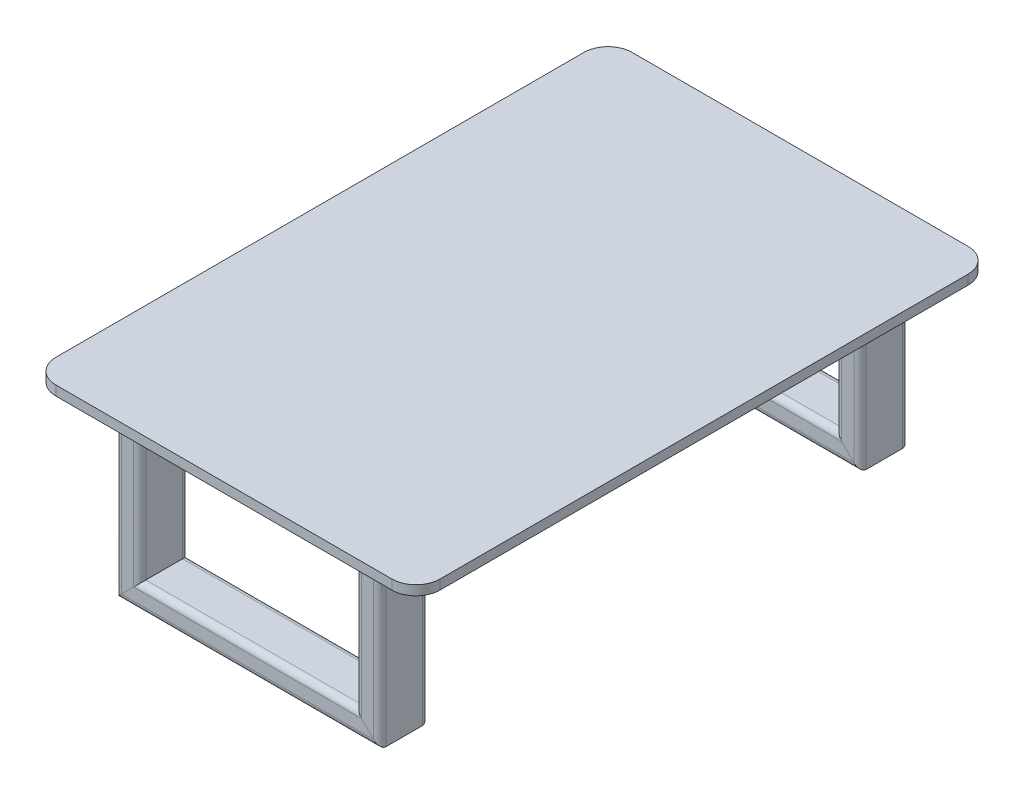
from build123d import *

# Parameters (mm, degrees)
TUBO_RECTANGULAR_4_X_2_X_0_25_1_DEPTH      = 57.79611679
TUBO_RECTANGULAR_4_X_2_X_0_25_1_DEPTH_BACK = 557.79611679
TUBO_RECTANGULAR_4_X_2_X_0_25_1_2_DEPTH    = 415.59223358
TUBO_RECTANGULAR_4_X_2_X_0_25_1_3_DEPTH    = 615.59223358
TUBO_RECTANGULAR_4_X_2_X_0_25_1_4_DEPTH    = 415.59223358
TUBO_RECTANGULAR_4_X_2_X_0_25_1_5_DEPTH    = 615.59223358
TUBO_RECTANGULAR_4_X_2_X_0_25_1_6_DEPTH    = 415.59223358
TUBO_RECTANGULAR_4_X_2_X_0_25_1_7_DEPTH    = 615.59223358
TUBO_RECTANGULAR_4_X_2_X_0_25_1_8_DEPTH    = 415.59223358
SALIENTE_EXTRUIR1_DEPTH                    = 20


with BuildPart() as part:
    # Sketch12 → Tubo rectangular 4 X 2 X 0.25(1) (new, two sides: drawn at the far end of the back side and taken through both)
    with BuildSketch(Plane(origin=(-250, 150, 0), x_dir=(0, 1, 0), z_dir=(-1, 0, 0)).offset(-TUBO_RECTANGULAR_4_X_2_X_0_25_1_DEPTH_BACK)):
        with BuildLine():
            Line((-12.699978, -50.8), (12.699978, -50.8))
            ThreePointArc((12.699978, -50.8), (21.680234121, -47.080256121), (25.399978, -38.1))
            Line((25.399978, -38.1), (25.399978, 38.1))
            ThreePointArc((25.399978, 38.1), (21.680234121, 47.080256121), (12.699978, 50.8))
            Line((12.699978, 50.8), (-12.699978, 50.8))
            ThreePointArc((-12.699978, 50.8), (-21.680234121, 47.080256121), (-25.399978, 38.1))
            Line((-25.399978, 38.1), (-25.399978, -38.1))
            ThreePointArc((-25.399978, -38.1), (-21.680234121, -47.080256121), (-12.699978, -50.8))
        make_face()
        with BuildLine():
            Line((-12.699978, -44.45), (12.699978, -44.45))
            ThreePointArc((12.699978, -44.45), (17.190106061, -42.590128061), (19.049978, -38.1))
            Line((19.049978, -38.1), (19.049978, 38.1))
            ThreePointArc((19.049978, 38.1), (17.190106061, 42.590128061), (12.699978, 44.45))
            Line((12.699978, 44.45), (-12.699978, 44.45))
            ThreePointArc((-12.699978, 44.45), (-17.190106061, 42.590128061), (-19.049978, 38.1))
            Line((-19.049978, 38.1), (-19.049978, -38.1))
            ThreePointArc((-19.049978, -38.1), (-17.190106061, -42.590128061), (-12.699978, -44.45))
        make_face(mode=Mode.SUBTRACT)
    extrude(amount=TUBO_RECTANGULAR_4_X_2_X_0_25_1_DEPTH + TUBO_RECTANGULAR_4_X_2_X_0_25_1_DEPTH_BACK)

    # Tubo rectangular 4 X 2 X 0.25(1) mitre 1
    split(bisect_by=Plane(origin=(-250, 150, 0), x_dir=(-0.707106781, 0.707106781, 0), z_dir=(0.707106781, 0.707106781, 0)), keep=Keep.TOP)

    # Tubo rectangular 4 X 2 X 0.25(1) mitre 2
    split(bisect_by=Plane(origin=(250, 150, 0), x_dir=(-0.707106781, -0.707106781, 0), z_dir=(-0.707106781, 0.707106781, 0)), keep=Keep.TOP)


with BuildPart() as body_2:
    # Sketch12 on segment 2 (carried to segment 2) → Tubo rectangular 4 X 2 X 0.25_1 2 (new body)
    with BuildSketch(Plane(origin=(250, 207.79611679, 0), x_dir=(-1, 0, 0), z_dir=(0, -1, 0))):
        with BuildLine():
            Line((-12.699978, -50.8), (12.699978, -50.8))
            ThreePointArc((12.699978, -50.8), (21.680234121, -47.080256121), (25.399978, -38.1))
            Line((25.399978, -38.1), (25.399978, 38.1))
            ThreePointArc((25.399978, 38.1), (21.680234121, 47.080256121), (12.699978, 50.8))
            Line((12.699978, 50.8), (-12.699978, 50.8))
            ThreePointArc((-12.699978, 50.8), (-21.680234121, 47.080256121), (-25.399978, 38.1))
            Line((-25.399978, 38.1), (-25.399978, -38.1))
            ThreePointArc((-25.399978, -38.1), (-21.680234121, -47.080256121), (-12.699978, -50.8))
        make_face()
        with BuildLine():
            Line((-12.699978, -44.45), (12.699978, -44.45))
            ThreePointArc((12.699978, -44.45), (17.190106061, -42.590128061), (19.049978, -38.1))
            Line((19.049978, -38.1), (19.049978, 38.1))
            ThreePointArc((19.049978, 38.1), (17.190106061, 42.590128061), (12.699978, 44.45))
            Line((12.699978, 44.45), (-12.699978, 44.45))
            ThreePointArc((-12.699978, 44.45), (-17.190106061, 42.590128061), (-19.049978, 38.1))
            Line((-19.049978, 38.1), (-19.049978, -38.1))
            ThreePointArc((-19.049978, -38.1), (-17.190106061, -42.590128061), (-12.699978, -44.45))
        make_face(mode=Mode.SUBTRACT)
    extrude(amount=TUBO_RECTANGULAR_4_X_2_X_0_25_1_2_DEPTH)

    # Tubo rectangular 4 X 2 X 0.25_1 2 mitre
    split(bisect_by=Plane(origin=(250, -150, 0), x_dir=(-0.707106781, 0.707106781, 0), z_dir=(0.707106781, 0.707106781, 0)), keep=Keep.TOP)

    # Tubo rectangular 4 X 2 X 0.25_1 2 mi 2
    split(bisect_by=Plane(origin=(250, 150, 0), x_dir=(0.707106781, 0.707106781, 0), z_dir=(0.707106781, -0.707106781, 0)), keep=Keep.TOP)


with BuildPart() as body_3:
    # Sketch12 on segment 3 (carried to segment 3) → Tubo rectangular 4 X 2 X 0.25_1 3 (new body)
    with BuildSketch(Plane(origin=(307.79611679, -150, 0), x_dir=(0, 1, 0), z_dir=(-1, 0, 0))):
        with BuildLine():
            Line((-12.699978, -50.8), (12.699978, -50.8))
            ThreePointArc((12.699978, -50.8), (21.680234121, -47.080256121), (25.399978, -38.1))
            Line((25.399978, -38.1), (25.399978, 38.1))
            ThreePointArc((25.399978, 38.1), (21.680234121, 47.080256121), (12.699978, 50.8))
            Line((12.699978, 50.8), (-12.699978, 50.8))
            ThreePointArc((-12.699978, 50.8), (-21.680234121, 47.080256121), (-25.399978, 38.1))
            Line((-25.399978, 38.1), (-25.399978, -38.1))
            ThreePointArc((-25.399978, -38.1), (-21.680234121, -47.080256121), (-12.699978, -50.8))
        make_face()
        with BuildLine():
            Line((-12.699978, -44.45), (12.699978, -44.45))
            ThreePointArc((12.699978, -44.45), (17.190106061, -42.590128061), (19.049978, -38.1))
            Line((19.049978, -38.1), (19.049978, 38.1))
            ThreePointArc((19.049978, 38.1), (17.190106061, 42.590128061), (12.699978, 44.45))
            Line((12.699978, 44.45), (-12.699978, 44.45))
            ThreePointArc((-12.699978, 44.45), (-17.190106061, 42.590128061), (-19.049978, 38.1))
            Line((-19.049978, 38.1), (-19.049978, -38.1))
            ThreePointArc((-19.049978, -38.1), (-17.190106061, -42.590128061), (-12.699978, -44.45))
        make_face(mode=Mode.SUBTRACT)
    extrude(amount=TUBO_RECTANGULAR_4_X_2_X_0_25_1_3_DEPTH)

    # Tubo rectangular 4 X 2 X 0.25_1 3 mitre
    split(bisect_by=Plane(origin=(-250, -150, 0), x_dir=(0.707106781, 0.707106781, 0), z_dir=(0.707106781, -0.707106781, 0)), keep=Keep.TOP)

    # Tubo rectangular 4 X 2 X 0.25_1 3 mi 2
    split(bisect_by=Plane(origin=(250, -150, 0), x_dir=(0.707106781, -0.707106781, 0), z_dir=(-0.707106781, -0.707106781, 0)), keep=Keep.TOP)


with BuildPart() as body_4:
    # Sketch12 on segment 4 (carried to segment 4) → Tubo rectangular 4 X 2 X 0.25_1 4 (new body)
    with BuildSketch(Plane(origin=(-250, 207.79611679, 0), x_dir=(-1, 0, 0), z_dir=(0, -1, 0))):
        with BuildLine():
            Line((-12.699978, -50.8), (12.699978, -50.8))
            ThreePointArc((12.699978, -50.8), (21.680234121, -47.080256121), (25.399978, -38.1))
            Line((25.399978, -38.1), (25.399978, 38.1))
            ThreePointArc((25.399978, 38.1), (21.680234121, 47.080256121), (12.699978, 50.8))
            Line((12.699978, 50.8), (-12.699978, 50.8))
            ThreePointArc((-12.699978, 50.8), (-21.680234121, 47.080256121), (-25.399978, 38.1))
            Line((-25.399978, 38.1), (-25.399978, -38.1))
            ThreePointArc((-25.399978, -38.1), (-21.680234121, -47.080256121), (-12.699978, -50.8))
        make_face()
        with BuildLine():
            Line((-12.699978, -44.45), (12.699978, -44.45))
            ThreePointArc((12.699978, -44.45), (17.190106061, -42.590128061), (19.049978, -38.1))
            Line((19.049978, -38.1), (19.049978, 38.1))
            ThreePointArc((19.049978, 38.1), (17.190106061, 42.590128061), (12.699978, 44.45))
            Line((12.699978, 44.45), (-12.699978, 44.45))
            ThreePointArc((-12.699978, 44.45), (-17.190106061, 42.590128061), (-19.049978, 38.1))
            Line((-19.049978, 38.1), (-19.049978, -38.1))
            ThreePointArc((-19.049978, -38.1), (-17.190106061, -42.590128061), (-12.699978, -44.45))
        make_face(mode=Mode.SUBTRACT)
    extrude(amount=TUBO_RECTANGULAR_4_X_2_X_0_25_1_4_DEPTH)

    # Tubo rectangular 4 X 2 X 0.25_1 4 mitre
    split(bisect_by=Plane(origin=(-250, -150, 0), x_dir=(-0.707106781, -0.707106781, 0), z_dir=(-0.707106781, 0.707106781, 0)), keep=Keep.TOP)

    # Tubo rectangular 4 X 2 X 0.25_1 4 mi 2
    split(bisect_by=Plane(origin=(-250, 150, 0), x_dir=(0.707106781, -0.707106781, 0), z_dir=(-0.707106781, -0.707106781, 0)), keep=Keep.TOP)


with BuildPart() as body_5:
    # Sketch12 on segment 5 (carried to segment 5) → Tubo rectangular 4 X 2 X 0.25_1 5 (new body)
    with BuildSketch(Plane(origin=(307.79611679, 150, -1000), x_dir=(0, 1, 0), z_dir=(-1, 0, 0))):
        with BuildLine():
            Line((-12.699978, -50.8), (12.699978, -50.8))
            ThreePointArc((12.699978, -50.8), (21.680234121, -47.080256121), (25.399978, -38.1))
            Line((25.399978, -38.1), (25.399978, 38.1))
            ThreePointArc((25.399978, 38.1), (21.680234121, 47.080256121), (12.699978, 50.8))
            Line((12.699978, 50.8), (-12.699978, 50.8))
            ThreePointArc((-12.699978, 50.8), (-21.680234121, 47.080256121), (-25.399978, 38.1))
            Line((-25.399978, 38.1), (-25.399978, -38.1))
            ThreePointArc((-25.399978, -38.1), (-21.680234121, -47.080256121), (-12.699978, -50.8))
        make_face()
        with BuildLine():
            Line((-12.699978, -44.45), (12.699978, -44.45))
            ThreePointArc((12.699978, -44.45), (17.190106061, -42.590128061), (19.049978, -38.1))
            Line((19.049978, -38.1), (19.049978, 38.1))
            ThreePointArc((19.049978, 38.1), (17.190106061, 42.590128061), (12.699978, 44.45))
            Line((12.699978, 44.45), (-12.699978, 44.45))
            ThreePointArc((-12.699978, 44.45), (-17.190106061, 42.590128061), (-19.049978, 38.1))
            Line((-19.049978, 38.1), (-19.049978, -38.1))
            ThreePointArc((-19.049978, -38.1), (-17.190106061, -42.590128061), (-12.699978, -44.45))
        make_face(mode=Mode.SUBTRACT)
    extrude(amount=TUBO_RECTANGULAR_4_X_2_X_0_25_1_5_DEPTH)

    # Tubo rectangular 4 X 2 X 0.25_1 5 mitre
    split(bisect_by=Plane(origin=(-250, 150, -1000), x_dir=(-0.707106781, 0.707106781, 0), z_dir=(0.707106781, 0.707106781, 0)), keep=Keep.TOP)

    # Tubo rectangular 4 X 2 X 0.25_1 5 mi 2
    split(bisect_by=Plane(origin=(250, 150, -1000), x_dir=(-0.707106781, -0.707106781, 0), z_dir=(-0.707106781, 0.707106781, 0)), keep=Keep.TOP)


with BuildPart() as body_6:
    # Sketch12 on segment 6 (carried to segment 6) → Tubo rectangular 4 X 2 X 0.25_1 6 (new body)
    with BuildSketch(Plane(origin=(250, 207.79611679, -1000), x_dir=(-1, 0, 0), z_dir=(0, -1, 0))):
        with BuildLine():
            Line((-12.699978, -50.8), (12.699978, -50.8))
            ThreePointArc((12.699978, -50.8), (21.680234121, -47.080256121), (25.399978, -38.1))
            Line((25.399978, -38.1), (25.399978, 38.1))
            ThreePointArc((25.399978, 38.1), (21.680234121, 47.080256121), (12.699978, 50.8))
            Line((12.699978, 50.8), (-12.699978, 50.8))
            ThreePointArc((-12.699978, 50.8), (-21.680234121, 47.080256121), (-25.399978, 38.1))
            Line((-25.399978, 38.1), (-25.399978, -38.1))
            ThreePointArc((-25.399978, -38.1), (-21.680234121, -47.080256121), (-12.699978, -50.8))
        make_face()
        with BuildLine():
            Line((-12.699978, -44.45), (12.699978, -44.45))
            ThreePointArc((12.699978, -44.45), (17.190106061, -42.590128061), (19.049978, -38.1))
            Line((19.049978, -38.1), (19.049978, 38.1))
            ThreePointArc((19.049978, 38.1), (17.190106061, 42.590128061), (12.699978, 44.45))
            Line((12.699978, 44.45), (-12.699978, 44.45))
            ThreePointArc((-12.699978, 44.45), (-17.190106061, 42.590128061), (-19.049978, 38.1))
            Line((-19.049978, 38.1), (-19.049978, -38.1))
            ThreePointArc((-19.049978, -38.1), (-17.190106061, -42.590128061), (-12.699978, -44.45))
        make_face(mode=Mode.SUBTRACT)
    extrude(amount=TUBO_RECTANGULAR_4_X_2_X_0_25_1_6_DEPTH)

    # Tubo rectangular 4 X 2 X 0.25_1 6 mitre
    split(bisect_by=Plane(origin=(250, -150, -1000), x_dir=(-0.707106781, 0.707106781, 0), z_dir=(0.707106781, 0.707106781, 0)), keep=Keep.TOP)

    # Tubo rectangular 4 X 2 X 0.25_1 6 mi 2
    split(bisect_by=Plane(origin=(250, 150, -1000), x_dir=(0.707106781, 0.707106781, 0), z_dir=(0.707106781, -0.707106781, 0)), keep=Keep.TOP)


with BuildPart() as body_7:
    # Sketch12 on segment 7 (carried to segment 7) → Tubo rectangular 4 X 2 X 0.25_1 7 (new body)
    with BuildSketch(Plane(origin=(307.79611679, -150, -1000), x_dir=(0, 1, 0), z_dir=(-1, 0, 0))):
        with BuildLine():
            Line((-12.699978, -50.8), (12.699978, -50.8))
            ThreePointArc((12.699978, -50.8), (21.680234121, -47.080256121), (25.399978, -38.1))
            Line((25.399978, -38.1), (25.399978, 38.1))
            ThreePointArc((25.399978, 38.1), (21.680234121, 47.080256121), (12.699978, 50.8))
            Line((12.699978, 50.8), (-12.699978, 50.8))
            ThreePointArc((-12.699978, 50.8), (-21.680234121, 47.080256121), (-25.399978, 38.1))
            Line((-25.399978, 38.1), (-25.399978, -38.1))
            ThreePointArc((-25.399978, -38.1), (-21.680234121, -47.080256121), (-12.699978, -50.8))
        make_face()
        with BuildLine():
            Line((-12.699978, -44.45), (12.699978, -44.45))
            ThreePointArc((12.699978, -44.45), (17.190106061, -42.590128061), (19.049978, -38.1))
            Line((19.049978, -38.1), (19.049978, 38.1))
            ThreePointArc((19.049978, 38.1), (17.190106061, 42.590128061), (12.699978, 44.45))
            Line((12.699978, 44.45), (-12.699978, 44.45))
            ThreePointArc((-12.699978, 44.45), (-17.190106061, 42.590128061), (-19.049978, 38.1))
            Line((-19.049978, 38.1), (-19.049978, -38.1))
            ThreePointArc((-19.049978, -38.1), (-17.190106061, -42.590128061), (-12.699978, -44.45))
        make_face(mode=Mode.SUBTRACT)
    extrude(amount=TUBO_RECTANGULAR_4_X_2_X_0_25_1_7_DEPTH)

    # Tubo rectangular 4 X 2 X 0.25_1 7 mitre
    split(bisect_by=Plane(origin=(-250, -150, -1000), x_dir=(0.707106781, 0.707106781, 0), z_dir=(0.707106781, -0.707106781, 0)), keep=Keep.TOP)

    # Tubo rectangular 4 X 2 X 0.25_1 7 mi 2
    split(bisect_by=Plane(origin=(250, -150, -1000), x_dir=(0.707106781, -0.707106781, 0), z_dir=(-0.707106781, -0.707106781, 0)), keep=Keep.TOP)


with BuildPart() as body_8:
    # Sketch12 on segment 8 (carried to segment 8) → Tubo rectangular 4 X 2 X 0.25_1 8 (new body)
    with BuildSketch(Plane(origin=(-250, 207.79611679, -1000), x_dir=(-1, 0, 0), z_dir=(0, -1, 0))):
        with BuildLine():
            Line((-12.699978, -50.8), (12.699978, -50.8))
            ThreePointArc((12.699978, -50.8), (21.680234121, -47.080256121), (25.399978, -38.1))
            Line((25.399978, -38.1), (25.399978, 38.1))
            ThreePointArc((25.399978, 38.1), (21.680234121, 47.080256121), (12.699978, 50.8))
            Line((12.699978, 50.8), (-12.699978, 50.8))
            ThreePointArc((-12.699978, 50.8), (-21.680234121, 47.080256121), (-25.399978, 38.1))
            Line((-25.399978, 38.1), (-25.399978, -38.1))
            ThreePointArc((-25.399978, -38.1), (-21.680234121, -47.080256121), (-12.699978, -50.8))
        make_face()
        with BuildLine():
            Line((-12.699978, -44.45), (12.699978, -44.45))
            ThreePointArc((12.699978, -44.45), (17.190106061, -42.590128061), (19.049978, -38.1))
            Line((19.049978, -38.1), (19.049978, 38.1))
            ThreePointArc((19.049978, 38.1), (17.190106061, 42.590128061), (12.699978, 44.45))
            Line((12.699978, 44.45), (-12.699978, 44.45))
            ThreePointArc((-12.699978, 44.45), (-17.190106061, 42.590128061), (-19.049978, 38.1))
            Line((-19.049978, 38.1), (-19.049978, -38.1))
            ThreePointArc((-19.049978, -38.1), (-17.190106061, -42.590128061), (-12.699978, -44.45))
        make_face(mode=Mode.SUBTRACT)
    extrude(amount=TUBO_RECTANGULAR_4_X_2_X_0_25_1_8_DEPTH)

    # Tubo rectangular 4 X 2 X 0.25_1 8 mitre
    split(bisect_by=Plane(origin=(-250, -150, -1000), x_dir=(-0.707106781, -0.707106781, 0), z_dir=(-0.707106781, 0.707106781, 0)), keep=Keep.TOP)

    # Tubo rectangular 4 X 2 X 0.25_1 8 mi 2
    split(bisect_by=Plane(origin=(-250, 150, -1000), x_dir=(0.707106781, -0.707106781, 0), z_dir=(-0.707106781, -0.707106781, 0)), keep=Keep.TOP)


with BuildPart() as body_9:
    # Croquis5 → Saliente-Extruir1 (new body)
    with BuildSketch(Plane(origin=(0, 175.399978, 0), x_dir=(1, 0, 0), z_dir=(0, 1, 0))):
        with BuildLine():
            Line((-350, -100), (350, -100))
            ThreePointArc((350, -100), (385.355339059, -85.355339059), (400, -50))
            Line((400, -50), (400, 1050))
            ThreePointArc((400, 1050), (385.355339059, 1085.355339059), (350, 1100))
            Line((350, 1100), (-350, 1100))
            ThreePointArc((-350, 1100), (-385.355339059, 1085.355339059), (-400, 1050))
            Line((-400, 1050), (-400, -50))
            ThreePointArc((-400, -50), (-385.355339059, -85.355339059), (-350, -100))
        make_face()
    extrude(amount=SALIENTE_EXTRUIR1_DEPTH)


solid = Compound([part.part, body_2.part, body_3.part, body_4.part, body_5.part, body_6.part, body_7.part, body_8.part, body_9.part])
